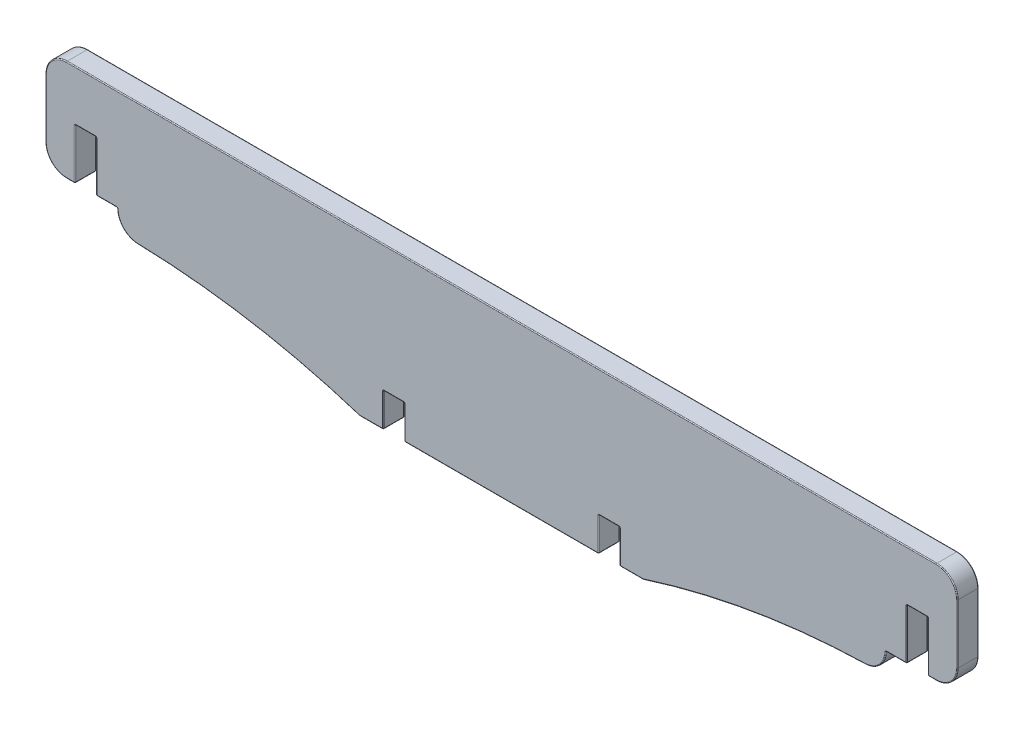
from build123d import *

# Parameters (mm, degrees)
RESSALTO_EXTRUS_O1_DEPTH = 2.5
FILETE1_R                = 0.1
FILETE2_R                = 0.1
FILETE3_R                = 0.1
FILETE4_R                = 0.1


with BuildPart() as part:
    # Esboço1 → Ressalto-extrusão1 (new body)
    with BuildSketch(Plane.XY):
        with BuildLine():
            ThreePointArc((99.421979142, 41.595321348), (86.129987151, 40.298688058), (73.157001804, 37.126944035))
            Line((73.157001804, 37.126944035), (70.35705856, 37.126944035))
            Line((70.35705856, 37.126944035), (70.35705856, 41.126944035))
            Line((70.35705856, 41.126944035), (67.85705856, 41.126944035))
            Line((67.85705856, 41.126944035), (67.85705856, 37.126944035))
            Line((67.85705856, 37.126944035), (44.85705856, 37.126944035))
            Line((44.85705856, 37.126944035), (44.85705856, 41.126944035))
            Line((44.85705856, 41.126944035), (42.35705856, 41.126944035))
            Line((42.35705856, 41.126944035), (42.35705856, 37.126944035))
            Line((42.35705856, 37.126944035), (39.557115316, 37.126944035))
            ThreePointArc((39.557115316, 37.126944035), (26.584129969, 40.298688058), (13.292137979, 41.595321348))
            ThreePointArc((13.292137979, 41.595321348), (11.566485823, 42.349815187), (10.85705856, 44.09447827))
            Line((10.85705856, 44.09447827), (10.85705856, 44.126944035))
            Line((10.85705856, 44.126944035), (8.35705856, 44.126944035))
            Line((8.35705856, 44.126944035), (8.35705856, 50.126944035))
            Line((8.35705856, 50.126944035), (5.85705856, 50.126944035))
            Line((5.85705856, 50.126944035), (5.85705856, 44.126944035))
            Line((5.85705856, 44.126944035), (4.85705856, 44.126944035))
            ThreePointArc((4.85705856, 44.126944035), (3.089291607, 44.859177082), (2.35705856, 46.626944035))
            Line((2.35705856, 46.626944035), (2.35705856, 53.626944035))
            ThreePointArc((2.35705856, 53.626944035), (3.089291607, 55.394710987), (4.85705856, 56.126944035))
            Line((4.85705856, 56.126944035), (107.85705856, 56.126944035))
            ThreePointArc((107.85705856, 56.126944035), (109.624825513, 55.394710987), (110.35705856, 53.626944035))
            Line((110.35705856, 53.626944035), (110.35705856, 46.626944035))
            ThreePointArc((110.35705856, 46.626944035), (109.624825513, 44.859177082), (107.85705856, 44.126944035))
            Line((107.85705856, 44.126944035), (106.85705856, 44.126944035))
            Line((106.85705856, 44.126944035), (106.85705856, 50.126944035))
            Line((106.85705856, 50.126944035), (104.35705856, 50.126944035))
            Line((104.35705856, 50.126944035), (104.35705856, 44.126944035))
            Line((104.35705856, 44.126944035), (101.85705856, 44.126944035))
            Line((101.85705856, 44.126944035), (101.85705856, 44.09447827))
            ThreePointArc((101.85705856, 44.09447827), (101.147631297, 42.349815187), (99.421979142, 41.595321348))
        make_face()
    extrude(amount=RESSALTO_EXTRUS_O1_DEPTH)

    # Filete1
    filete1_edges = [part.edges().sort_by_distance(p)[0] for p in [
        (70.35705856, 41.126944035, 1.25),
        (5.85705856, 50.126944035, 1.25),
        (106.85705856, 50.126944035, 1.25),
        (104.35705856, 50.126944035, 1.25),
    ]]
    fillet(filete1_edges, radius=FILETE1_R)

    # Filete2
    filete2_edges = [part.edges().sort_by_distance(p)[0] for p in [
        (101.85705856, 44.126944035, 1.25),
        (42.35705856, 41.126944035, 1.25),
        (44.85705856, 41.126944035, 1.25),
        (67.85705856, 41.126944035, 1.25),
    ]]
    fillet(filete2_edges, radius=FILETE2_R)

    # Filete3
    filete3_edges = [part.edges().sort_by_distance(p)[0] for p in [
        (10.85705856, 44.126944035, 1.25),
        (8.35705856, 50.126944035, 1.25),
    ]]
    fillet(filete3_edges, radius=FILETE3_R)

    # Filete4
    filete4_edges = [part.edges().sort_by_distance(p)[0] for p in [
        (42.35705856, 39.076944035, 2.5),
        (44.85705856, 39.076944035, 2.5),
        (56.35705856, 37.126944035, 2.5),
        (67.85705856, 39.076944035, 2.5),
        (70.35705856, 39.076944035, 2.5),
        (69.10705856, 41.126944035, 0),
        (69.10705856, 41.126944035, 2.5),
        (105.60705856, 50.126944035, 0),
        (105.60705856, 50.126944035, 2.5),
        (71.757030182, 37.126944035, 2.5),
        (104.35705856, 47.076944035, 0),
        (104.35705856, 47.076944035, 2.5),
        (106.85705856, 47.076944035, 0),
        (106.85705856, 47.076944035, 2.5),
        (7.10705856, 50.126944035, 0),
        (7.10705856, 50.126944035, 2.5),
        (5.85705856, 47.076944035, 0),
        (5.85705856, 47.076944035, 2.5),
        (70.327769238, 41.097654713, 0),
        (70.327769238, 41.097654713, 2.5),
        (104.386347882, 50.097654713, 0),
        (104.386347882, 50.097654713, 2.5),
        (106.827769238, 50.097654713, 0),
        (106.827769238, 50.097654713, 2.5),
        (5.886347882, 50.097654713, 0),
        (5.886347882, 50.097654713, 2.5),
        (43.60705856, 41.126944035, 0),
        (43.60705856, 41.126944035, 2.5),
        (101.12481979, 42.326705593, 0),
        (101.12481979, 42.326705593, 2.5),
        (42.386347882, 41.097654713, 0),
        (42.386347882, 41.097654713, 2.5),
        (44.827769238, 41.097654713, 0),
        (44.827769238, 41.097654713, 2.5),
        (67.886347882, 41.097654713, 0),
        (67.886347882, 41.097654713, 2.5),
        (101.88639503, 44.09856717, 0),
        (101.88639503, 44.09856717, 2.5),
        (103.156619941, 44.126944035, 2.5),
        (8.35705856, 47.076944035, 0),
        (8.35705856, 47.076944035, 2.5),
        (11.589297331, 42.326705593, 0),
        (11.589297331, 42.326705593, 2.5),
        (8.327769238, 50.097654713, 0),
        (8.327769238, 50.097654713, 2.5),
        (10.827722091, 44.09856717, 0),
        (10.827722091, 44.09856717, 2.5),
        (71.757030182, 37.126944035, 0),
        (70.35705856, 39.076944035, 0),
        (67.85705856, 39.076944035, 0),
        (56.35705856, 37.126944035, 0),
        (107.35705856, 44.126944035, 2.5),
        (44.85705856, 39.076944035, 0),
        (42.35705856, 39.076944035, 0),
        (40.957086938, 37.126944035, 0),
        (26.584129969, 40.298688058, 0),
        (9.55749718, 44.126944035, 0),
        (109.624825513, 44.859177082, 2.5),
        (5.35705856, 44.126944035, 0),
        (3.089291607, 44.859177082, 0),
        (2.35705856, 50.126944035, 0),
        (3.089291607, 55.394710987, 0),
        (56.35705856, 56.126944035, 0),
        (110.35705856, 50.126944035, 2.5),
        (109.624825513, 55.394710987, 0),
        (110.35705856, 50.126944035, 0),
        (109.624825513, 44.859177082, 0),
        (107.35705856, 44.126944035, 0),
        (103.156619941, 44.126944035, 0),
        (109.624825513, 55.394710987, 2.5),
        (86.129987151, 40.298688058, 0),
        (56.35705856, 56.126944035, 2.5),
        (86.129987151, 40.298688058, 2.5),
        (3.089291607, 55.394710987, 2.5),
        (73.157001804, 37.126944035, 1.25),
        (70.35705856, 37.126944035, 1.25),
        (67.85705856, 37.126944035, 1.25),
        (44.85705856, 37.126944035, 1.25),
        (2.35705856, 50.126944035, 2.5),
        (42.35705856, 37.126944035, 1.25),
        (39.557115316, 37.126944035, 1.25),
        (8.35705856, 44.126944035, 1.25),
        (5.85705856, 44.126944035, 1.25),
        (106.85705856, 44.126944035, 1.25),
        (104.35705856, 44.126944035, 1.25),
        (3.089291607, 44.859177082, 2.5),
        (5.35705856, 44.126944035, 2.5),
        (9.55749718, 44.126944035, 2.5),
        (26.584129969, 40.298688058, 2.5),
        (40.957086938, 37.126944035, 2.5),
    ]]
    fillet(filete4_edges, radius=FILETE4_R)


solid = part.part
